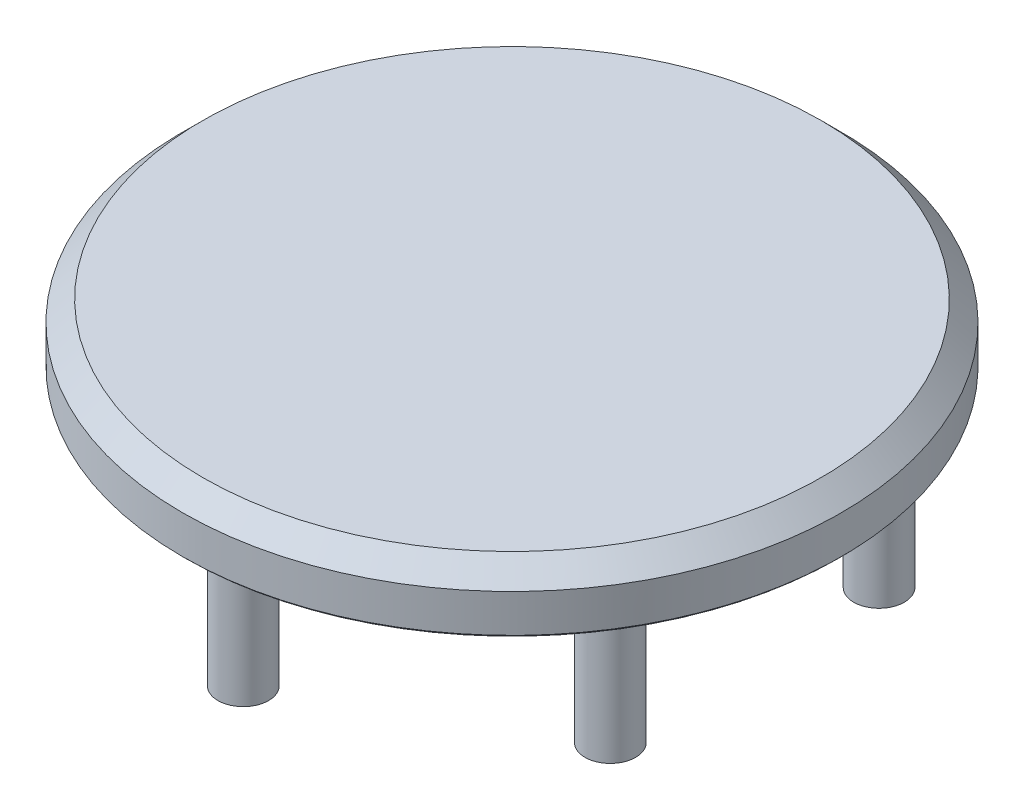
from build123d import *

# Parameters (mm, degrees)
SKETCH3_W           = 32.5
SKETCH3_H           = 6
CHAMFER2_SIZE       = 2
SKETCH4_R           = 2.5
BOSS_EXTRUDE1_DEPTH = 13.8
CIRPATTERN1_COUNT   = 6
CHAMFER3_SIZE       = 2
CHAMFER4_SIZE       = 0.25


with BuildPart() as part:
    # Sketch3 → Revolve1 (revolve)
    with BuildSketch(Plane(origin=(0, 0, 0), x_dir=(0, 0, -1), z_dir=(1, 0, 0))):
        with Locations((-16.25, 28)):
            Rectangle(SKETCH3_W, SKETCH3_H)
    revolve(axis=Axis((0, 0, 0), (0, -1, 0)))

    # Chamfer2
    chamfer2_edges = [part.edges().sort_by_distance(p)[0] for p in [
        (0, 31, -32.5),
    ]]
    chamfer(chamfer2_edges, length=CHAMFER2_SIZE)

    # Sketch4 → Boss-Extrude1 (add)
    with BuildSketch(Plane.XZ.offset(-25)):
        with Locations(Location((0, 26.5, 0), (0, 0, 180))):
            Circle(SKETCH4_R)
    boss_extrude1 = extrude(amount=BOSS_EXTRUDE1_DEPTH)

    # CirPattern1: Boss-Extrude1 ×6 about axis
    cirpattern1_axis = Axis((0, 0, 0), (0, 1, 0))
    for i in range(1, CIRPATTERN1_COUNT):
        add(boss_extrude1.rotate(cirpattern1_axis, i * 360 / CIRPATTERN1_COUNT))

    # Chamfer3
    chamfer3_edges = [part.edges().sort_by_distance(p)[0] for p in [
        (2.5, 25, 26.5),
        (24.1996732, 25, 11.084936491),
        (21.6996732, 25, -15.415063509),
        (-2.5, 25, -26.5),
        (-24.1996732, 25, -11.084936491),
        (-21.6996732, 25, 15.415063509),
    ]]
    chamfer(chamfer3_edges, length=CHAMFER3_SIZE)

    # Chamfer4
    chamfer4_edges = [part.edges().sort_by_distance(p)[0] for p in [
        (0, 25, -32.5),
    ]]
    chamfer(chamfer4_edges, length=CHAMFER4_SIZE)


solid = part.part
